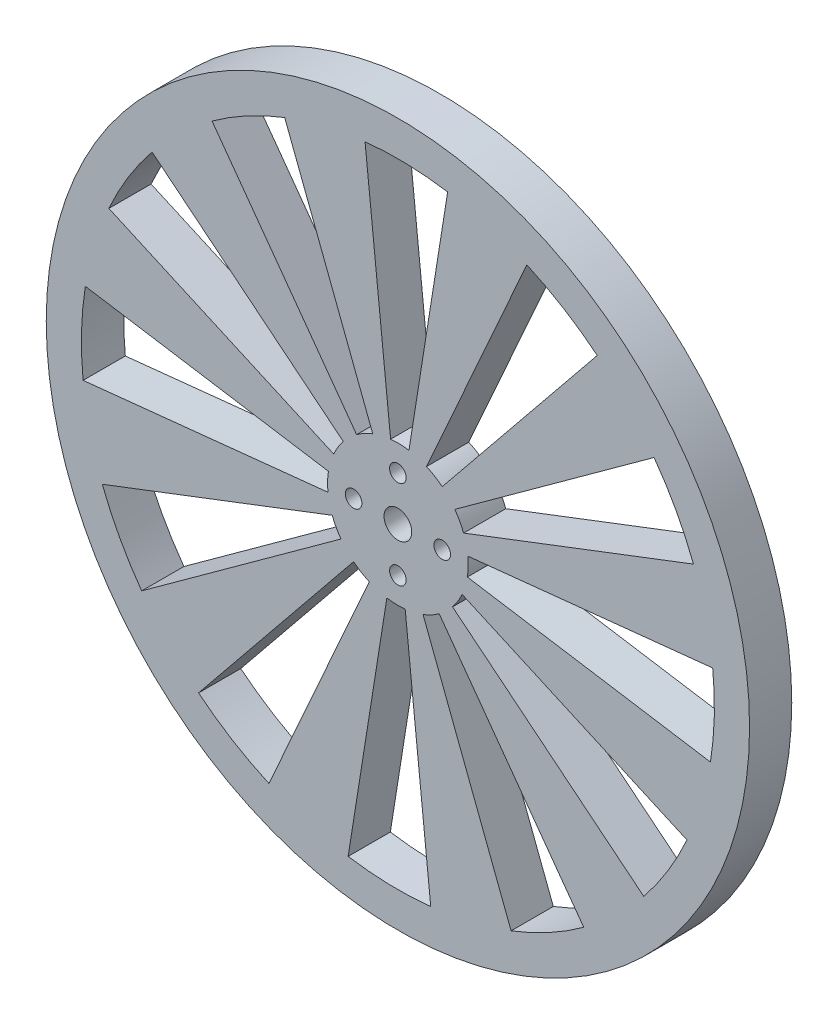
from build123d import *

# Parameters (mm, degrees)
SKETCH2_R           = 63.5
BOSS_EXTRUDE1_DEPTH = 7.62
CUT_EXTRUDE3_DEPTH  = 91.125270596
SKETCH6_R           = 1.5
CUT_EXTRUDE6_DEPTH  = 91.125270596
CIRPATTERN1_COUNT   = 4
SKETCH7_R           = 2.5
CUT_EXTRUDE5_DEPTH  = 91.125270596


with BuildPart() as part:
    # Sketch2 → Boss-Extrude1 (new body)
    with BuildSketch(Plane.XY):
        with Locations(Location((0, 0, 0), (0, 0, 180))):
            Circle(SKETCH2_R)
    extrude(amount=BOSS_EXTRUDE1_DEPTH)

    # Sketch5 → Cut-Extrude3 (cut, through all)
    with BuildSketch(Plane.XY.offset(7.62)):
        with BuildLine():
            ThreePointArc((-1.318093472, 12.631414394), (0.341913424, 12.695396615), (1.996070086, 12.54215708))
            Line((1.996070086, 12.54215708), (8.982315386, 56.439706859))
            ThreePointArc((8.982315386, 56.439706859), (1.538610407, 57.129284767), (-5.931420623, 56.841364774))
            Line((-5.931420623, 56.841364774), (-1.318093472, 12.631414394))
        make_face()
        with BuildLine():
            Line((23.283921447, 52.191776192), (5.174204766, 11.598172487))
            ThreePointArc((5.174204766, 11.598172487), (6.643804018, 10.823579268), (7.999725942, 9.863791606))
            Line((7.999725942, 9.863791606), (35.998766739, 44.387062229))
            ThreePointArc((35.998766739, 44.387062229), (29.897118082, 48.706106705), (23.283921447, 52.191776192))
        make_face()
        with BuildLine():
            ThreePointArc((10.280079015, 7.457209628), (11.165492692, 6.051592597), (11.859861692, 4.542431138))
            Line((11.859861692, 4.542431138), (53.369377615, 20.44094012))
            ThreePointArc((53.369377615, 20.44094012), (50.244717112, 27.232166685), (46.260355568, 33.557443327))
            Line((46.260355568, 33.557443327), (10.280079015, 7.457209628))
        make_face()
        with BuildLine():
            ThreePointArc((12.7, 0), (12.660477774, -1.00115061), (12.54215708, -1.996070086))
            Line((12.54215708, -1.996070086), (56.439706859, -8.982315386))
            ThreePointArc((56.439706859, -8.982315386), (56.972149981, -4.505177745), (57.15, 0))
            ThreePointArc((57.15, 0), (57.072789037, 2.969722475), (56.841364774, 5.931420623))
            Line((56.841364774, 5.931420623), (12.631414394, 1.318093472))
            ThreePointArc((12.631414394, 1.318093472), (12.682842008, 0.659938328), (12.7, 0))
        make_face()
        with BuildLine():
            ThreePointArc((11.598172487, -5.174204766), (10.823579268, -6.643804018), (9.863791606, -7.999725942))
            Line((9.863791606, -7.999725942), (44.387062229, -35.998766739))
            ThreePointArc((44.387062229, -35.998766739), (48.706106705, -29.897118082), (52.191776192, -23.283921447))
            Line((52.191776192, -23.283921447), (11.598172487, -5.174204766))
        make_face()
        with BuildLine():
            ThreePointArc((7.457209628, -10.280079015), (6.051592597, -11.165492692), (4.542431138, -11.859861692))
            Line((4.542431138, -11.859861692), (20.44094012, -53.369377615))
            ThreePointArc((20.44094012, -53.369377615), (27.232166685, -50.244717112), (33.557443327, -46.260355568))
            Line((33.557443327, -46.260355568), (7.457209628, -10.280079015))
        make_face()
        with BuildLine():
            ThreePointArc((1.318093472, -12.631414394), (-0.341913424, -12.695396615), (-1.996070086, -12.54215708))
            Line((-1.996070086, -12.54215708), (-8.982315386, -56.439706859))
            ThreePointArc((-8.982315386, -56.439706859), (-1.538610407, -57.129284767), (5.931420623, -56.841364774))
            Line((5.931420623, -56.841364774), (1.318093472, -12.631414394))
        make_face()
        with BuildLine():
            ThreePointArc((-5.174204766, -11.598172487), (-6.643804018, -10.823579268), (-7.999725942, -9.863791606))
            Line((-7.999725942, -9.863791606), (-35.998766739, -44.387062229))
            ThreePointArc((-35.998766739, -44.387062229), (-29.897118082, -48.706106705), (-23.283921447, -52.191776192))
            Line((-23.283921447, -52.191776192), (-5.174204766, -11.598172487))
        make_face()
        with BuildLine():
            ThreePointArc((-10.280079015, -7.457209628), (-11.165492692, -6.051592597), (-11.859861692, -4.542431138))
            Line((-11.859861692, -4.542431138), (-53.369377615, -20.44094012))
            ThreePointArc((-53.369377615, -20.44094012), (-50.244717112, -27.232166685), (-46.260355568, -33.557443327))
            Line((-46.260355568, -33.557443327), (-10.280079015, -7.457209628))
        make_face()
        with BuildLine():
            ThreePointArc((-12.631414394, -1.318093472), (-12.695396615, 0.341913424), (-12.54215708, 1.996070086))
            Line((-12.54215708, 1.996070086), (-56.439706859, 8.982315386))
            ThreePointArc((-56.439706859, 8.982315386), (-57.129284767, 1.538610407), (-56.841364774, -5.931420623))
            Line((-56.841364774, -5.931420623), (-12.631414394, -1.318093472))
        make_face()
        with BuildLine():
            ThreePointArc((-11.598172487, 5.174204766), (-10.823579268, 6.643804018), (-9.863791606, 7.999725942))
            Line((-9.863791606, 7.999725942), (-44.387062229, 35.998766739))
            ThreePointArc((-44.387062229, 35.998766739), (-48.706106705, 29.897118082), (-52.191776192, 23.283921447))
            Line((-52.191776192, 23.283921447), (-11.598172487, 5.174204766))
        make_face()
        with BuildLine():
            ThreePointArc((-7.457209628, 10.280079015), (-6.051592597, 11.165492692), (-4.542431138, 11.859861692))
            Line((-4.542431138, 11.859861692), (-20.44094012, 53.369377615))
            ThreePointArc((-20.44094012, 53.369377615), (-27.232166685, 50.244717112), (-33.557443327, 46.260355568))
            Line((-33.557443327, 46.260355568), (-7.457209628, 10.280079015))
        make_face()
    extrude(amount=-CUT_EXTRUDE3_DEPTH, mode=Mode.SUBTRACT)

    # Sketch6 → Cut-Extrude6 (cut, through all)
    with BuildSketch(Plane.XY.offset(7.62)):
        with Locations((0, 8)):
            Circle(SKETCH6_R)
    cut_extrude6 = extrude(amount=-CUT_EXTRUDE6_DEPTH, mode=Mode.SUBTRACT)

    # CirPattern1: Cut-Extrude6 ×4 about axis
    cirpattern1_axis = Axis((0, 0, 0), (0, 0, 1))
    for i in range(1, CIRPATTERN1_COUNT):
        add(cut_extrude6.rotate(cirpattern1_axis, i * 360 / CIRPATTERN1_COUNT), mode=Mode.SUBTRACT)

    # Sketch7 → Cut-Extrude5 (cut, through all)
    with BuildSketch(Plane.XY.offset(7.62)):
        Circle(SKETCH7_R)
    extrude(amount=-CUT_EXTRUDE5_DEPTH, mode=Mode.SUBTRACT)


solid = part.part
